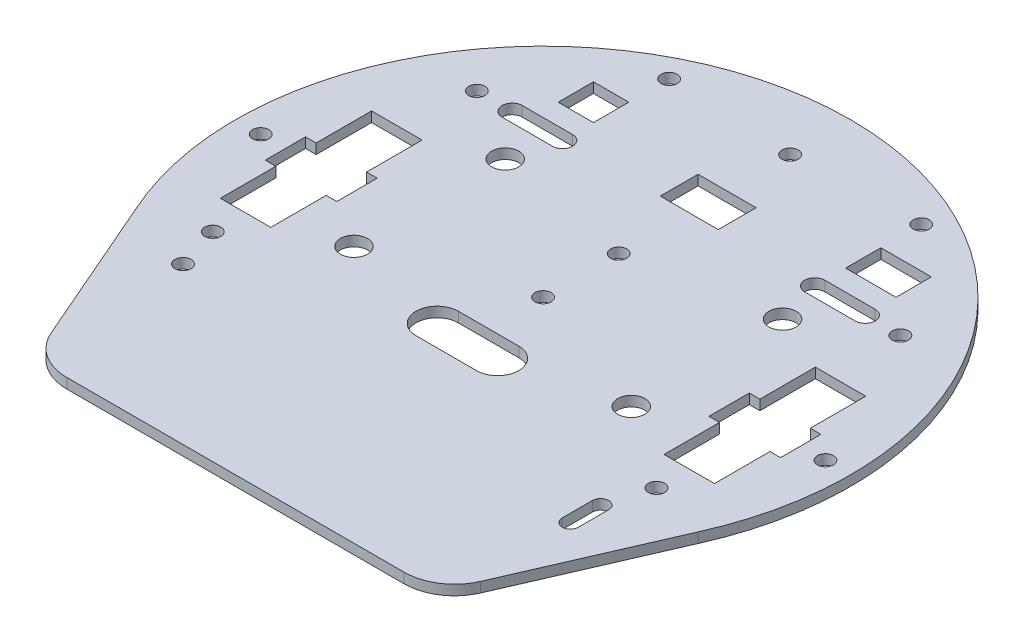
from build123d import *

# Parameters (mm, degrees)
SKETCH1_R           = 61
SKETCH1_R_2         = 2.7
SKETCH1_W           = 10
SKETCH1_H           = 30
BOSS_EXTRUDE1_DEPTH = 2
SKETCH2_W           = 11.5
SKETCH2_H           = 7.5
CUT_EXTRUDE1_DEPTH  = 87.290208019
SKETCH5_R           = 1.6
SKETCH5_W           = 7
SKETCH5_H           = 7
SKETCH5_W_2         = 10
CUT_EXTRUDE4_DEPTH  = 87.290208019
SKETCH6_W           = 14.2
SKETCH6_H           = 8
SKETCH6_R           = 1.6
CUT_EXTRUDE5_DEPTH  = 87.290208019
BOSS_EXTRUDE2_START = -2
BOSS_EXTRUDE2_DEPTH = 2
FILLET1_R           = 10


with BuildPart() as part:
    # Sketch1 → Boss-Extrude1 (new body)
    with BuildSketch(Plane(origin=(0, 0, 0), x_dir=(1, 0, 0), z_dir=(0, 1, 0))):
        Circle(SKETCH1_R)
        with Locations((-27.5, 20)):
            Circle(SKETCH1_R_2, mode=Mode.SUBTRACT)
        with Locations((-27.5, -10)):
            Circle(SKETCH1_R_2, mode=Mode.SUBTRACT)
        with Locations((27.5, -10)):
            Circle(SKETCH1_R_2, mode=Mode.SUBTRACT)
        with Locations((27.5, 20)):
            Circle(SKETCH1_R_2, mode=Mode.SUBTRACT)
        with Locations((44, 0)):
            Rectangle(SKETCH1_W, SKETCH1_H, mode=Mode.SUBTRACT)
        with Locations((-44, 0)):
            Rectangle(SKETCH1_W, SKETCH1_H, mode=Mode.SUBTRACT)
    extrude(amount=BOSS_EXTRUDE1_DEPTH)

    # Sketch2 → Cut-Extrude1 (cut, through all)
    with BuildSketch(Plane(origin=(0, 2, 0), x_dir=(1, 0, 0), z_dir=(0, 1, 0))):
        with Locations((0, 32.75)):
            Rectangle(SKETCH2_W, SKETCH2_H)
    extrude(amount=-CUT_EXTRUDE1_DEPTH, mode=Mode.SUBTRACT)

    # Sketch5 → Cut-Extrude4 (cut, through all)
    with BuildSketch(Plane.XZ):
        with Locations((42, -28.871979931)):
            Circle(SKETCH5_R)
        with Locations((-42, -28.871979931)):
            Circle(SKETCH5_R)
        with Locations((-41.4, 30)):
            Circle(SKETCH5_R)
        with BuildLine():
            Line((-35, -26.871979931), (-25, -26.871979931))
            ThreePointArc((-25, -26.871979931), (-23, -28.871979931), (-25, -30.871979931))
            Line((-25, -30.871979931), (-35, -30.871979931))
            ThreePointArc((-35, -30.871979931), (-37, -28.871979931), (-35, -26.871979931))
        make_face()
        with BuildLine():
            Line((35, -26.871979931), (25, -26.871979931))
            ThreePointArc((25, -26.871979931), (23, -28.871979931), (25, -30.871979931))
            Line((25, -30.871979931), (35, -30.871979931))
            ThreePointArc((35, -30.871979931), (37, -28.871979931), (35, -26.871979931))
        make_face()
        with BuildLine():
            Line((-6, 19.2), (6, 19.2))
            ThreePointArc((6, 19.2), (10.2, 15), (6, 10.8))
            Line((6, 10.8), (-6, 10.8))
            ThreePointArc((-6, 10.8), (-10.2, 15), (-6, 19.2))
        make_face()
        with Locations((-28.5, -38.5)):
            Rectangle(SKETCH5_W, SKETCH5_H)
        with BuildLine():
            Line((39.8, 30), (39.8, 36))
            ThreePointArc((39.8, 36), (41.4, 37.6), (43, 36))
            Line((43, 36), (43, 30))
            ThreePointArc((43, 30), (41.4, 28.4), (39.8, 30))
        make_face()
        with Locations((30, -38.5)):
            Rectangle(SKETCH5_W_2, SKETCH5_H)
    extrude(amount=-CUT_EXTRUDE4_DEPTH, mode=Mode.SUBTRACT)

    # Sketch6 → Cut-Extrude5 (cut, through all)
    with BuildSketch(Plane(origin=(0, 2, 0), x_dir=(1, 0, 0), z_dir=(0, 1, 0))):
        with Locations((44, 0)):
            Rectangle(SKETCH6_W, SKETCH6_H)
        with Locations((-44, 0)):
            Rectangle(SKETCH6_W, SKETCH6_H)
        with Locations((44, -21.5)):
            Circle(SKETCH6_R)
        with Locations((-44, -21.5)):
            Circle(SKETCH6_R)
        with Locations((0, 15)):
            Circle(SKETCH6_R)
        Circle(SKETCH6_R)
        with Locations((-56, 0)):
            Circle(SKETCH6_R)
        with Locations((56, 0)):
            Circle(SKETCH6_R)
        with Locations((-25, 50)):
            Circle(SKETCH6_R)
        with Locations((25, 50)):
            Circle(SKETCH6_R)
        with Locations((0, 49)):
            Circle(SKETCH6_R)
    extrude(amount=-CUT_EXTRUDE5_DEPTH, mode=Mode.SUBTRACT)

    # Sketch7 → Boss-Extrude2 (add)
    with BuildSketch(Plane(origin=(0, 2, 0), x_dir=(1, 0, 0), z_dir=(0, 1, 0)).offset(BOSS_EXTRUDE2_START)):
        with BuildLine():
            Line((-55.670050575, -24.93682957), (-40, -61))
            Line((-40, -61), (0, -61))
            ThreePointArc((0, -61), (-33.165142818, -51.196418838), (-55.670050575, -24.93682957))
        make_face()
        with BuildLine():
            ThreePointArc((55.670050575, -24.93682957), (33.165142818, -51.196418838), (0, -61))
            Line((0, -61), (40, -61))
            Line((40, -61), (55.670050575, -24.93682957))
        make_face()
    extrude(amount=BOSS_EXTRUDE2_DEPTH)

    # Fillet1
    fillet1_edges = [part.edges().sort_by_distance(p)[0] for p in [
        (40, 1, 61),
        (-40, 1, 61),
    ]]
    fillet(fillet1_edges, radius=FILLET1_R)


solid = part.part
